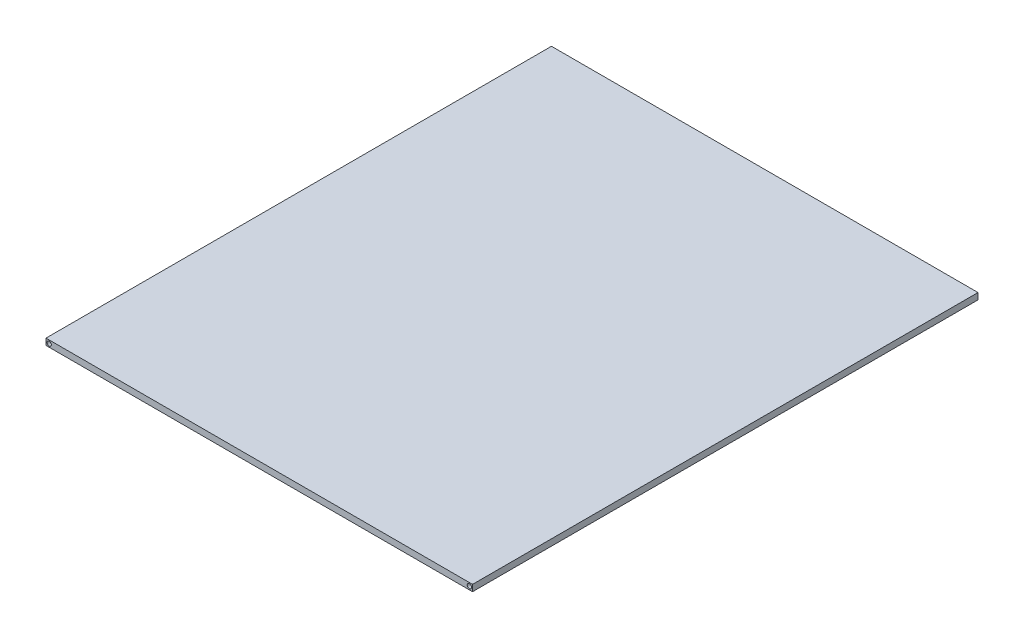
from build123d import *

# Parameters (mm, degrees)
SKETCH1_W           = 200
SKETCH1_H           = 237
BOSS_EXTRUDE1_DEPTH = 3
SKETCH4_R           = 0.995052607
SKETCH4_R_2         = 1
CUT_EXTRUDE1_DEPTH  = 10


with BuildPart() as part:
    # Sketch1 → Boss-Extrude1 (new body)
    with BuildSketch(Plane(origin=(0, 0, 0), x_dir=(1, 0, 0), z_dir=(0, 1, 0))):
        with Locations((100, -118.5)):
            Rectangle(SKETCH1_W, SKETCH1_H)
    extrude(amount=BOSS_EXTRUDE1_DEPTH)

    # Sketch4 → Cut-Extrude1 (cut)
    with BuildSketch(Plane.XY.offset(237)):
        with Locations((1.5, 1.5)):
            Circle(SKETCH4_R)
        with Locations((198.5, 1.5)):
            Circle(SKETCH4_R_2)
    cut_extrude1 = extrude(amount=-CUT_EXTRUDE1_DEPTH, mode=Mode.SUBTRACT)

    # Mirror1: Cut-Extrude1 across plane
    add(cut_extrude1.mirror(Plane(origin=(0, 0, 118.5), x_dir=(1, 0, 0), z_dir=(0, 0, -1))), mode=Mode.SUBTRACT)


solid = part.part
